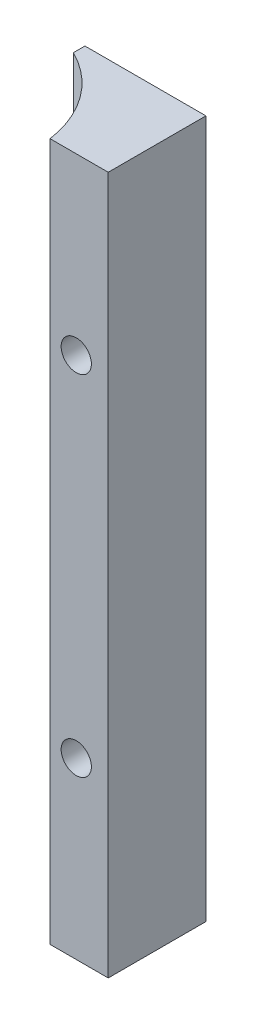
from build123d import *

# Parameters (mm, degrees)
BOSS_EXTRUDE1_DEPTH        = 60
F_2_6_2_6_DIAMETER_HOLE1_D = 2.6


with BuildPart() as part:
    # Sketch1 → Boss-Extrude1 (new body)
    with BuildSketch(Plane(origin=(0, 0, 0), x_dir=(1, 0, 0), z_dir=(0, 1, 0))):
        with BuildLine():
            Line((0, 0), (0, 8.4))
            Line((0, 8.4), (-10.402546471, 8.4))
            Line((-10.402546471, 8.4), (-10.402546471, 7.4))
            ThreePointArc((-10.402546471, 7.4), (-6.785865437, 4.368315294), (-5, 0))
            Line((-5, 0), (0, 0))
        make_face()
    extrude(amount=BOSS_EXTRUDE1_DEPTH)

    # Ø2.6 (2.6) Diameter Hole1 (through all)
    with Locations(Plane(origin=(-2.75, 45, 0), x_dir=(1, 0, 0), z_dir=(0, 0, 1))):
        with Locations((0, 0), (0, -30)):
            Hole(F_2_6_2_6_DIAMETER_HOLE1_D / 2)


solid = part.part
